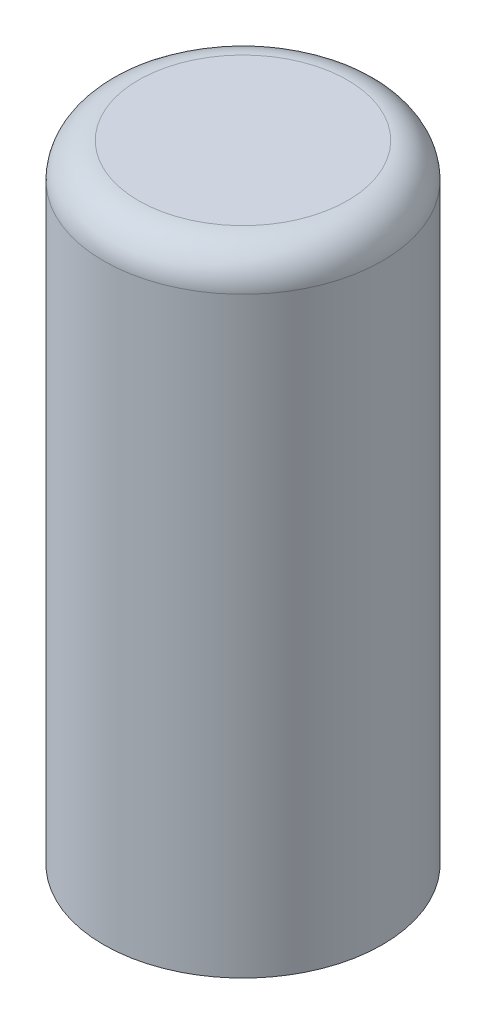
from build123d import *

# Parameters (mm, degrees)
SKETCH1_R           = 4
BOSS_EXTRUDE1_DEPTH = 10
BOSS_EXTRUDE2_START = 8
SKETCH2_R           = 4
BOSS_EXTRUDE2_DEPTH = 8
FILLET3_R           = 1


with BuildPart() as part:
    # Sketch1 → Boss-Extrude1 (new body)
    with BuildSketch(Plane(origin=(0, 0, 0), x_dir=(1, 0, 0), z_dir=(0, 1, 0))):
        with Locations(Location((0, 0, 0), (0, 0, 270))):
            Circle(SKETCH1_R)
    extrude(amount=BOSS_EXTRUDE1_DEPTH)

    # Sketch2 → Boss-Extrude2 (add)
    with BuildSketch(Plane.XZ.offset(BOSS_EXTRUDE2_START)):
        with Locations(Location((0, 0, 0), (0, 0, 270))):
            Circle(SKETCH2_R)
        with BuildLine():
            Line((-3.03407729, -0.5), (3.03407729, -0.5))
            ThreePointArc((3.03407729, -0.5), (0, -3.075), (-3.03407729, -0.5))
        make_face(mode=Mode.SUBTRACT)
        with BuildLine():
            Line((-3.03407729, 0.5), (3.03407729, 0.5))
            ThreePointArc((3.03407729, 0.5), (0, 3.075), (-3.03407729, 0.5))
        make_face(mode=Mode.SUBTRACT)
    extrude(amount=-BOSS_EXTRUDE2_DEPTH)

    # Fillet3
    fillet3_edges = [part.edges().sort_by_distance(p)[0] for p in [
        (0, 10, -4),
    ]]
    fillet(fillet3_edges, radius=FILLET3_R)


solid = part.part
